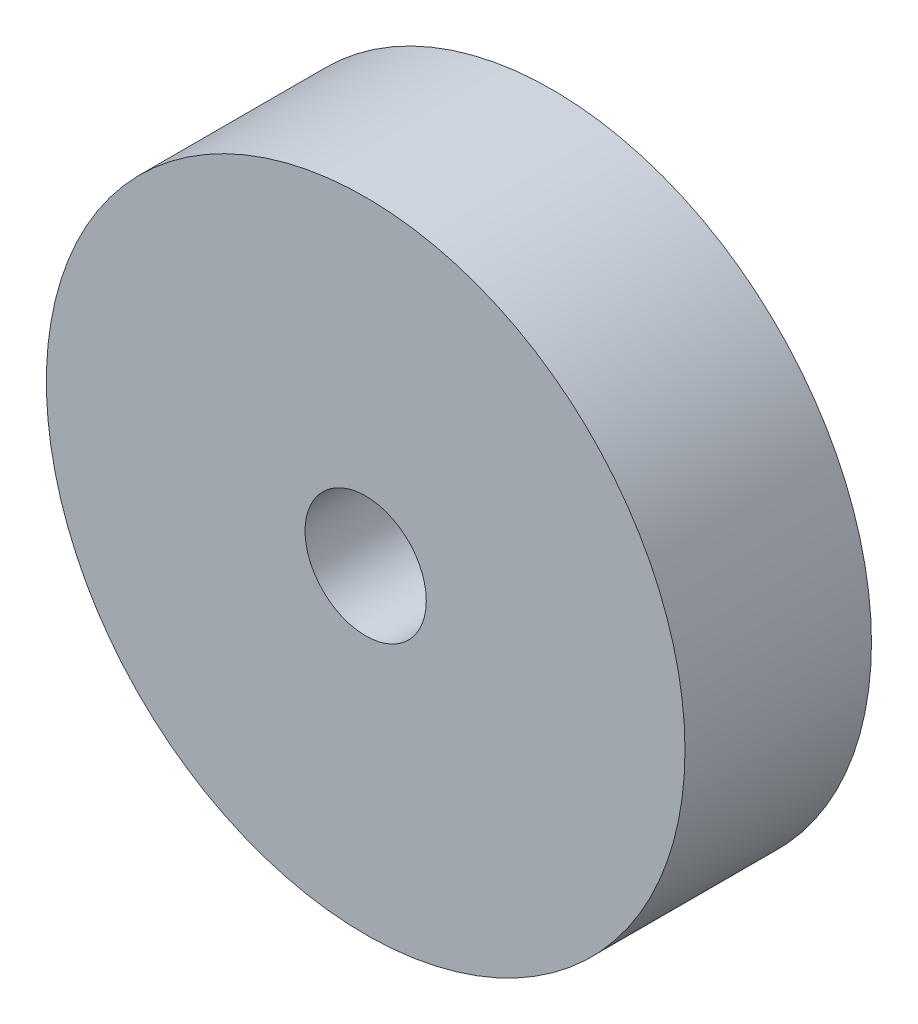
from build123d import *

# Parameters (mm, degrees)
SKETCH1_R           = 68.5
SKETCH1_R_2         = 13
BOSS_EXTRUDE1_DEPTH = 40


with BuildPart() as part:
    # Sketch1 → Boss-Extrude1 (new body)
    with BuildSketch(Plane.XY):
        Circle(SKETCH1_R)
        Circle(SKETCH1_R_2, mode=Mode.SUBTRACT)
    extrude(amount=BOSS_EXTRUDE1_DEPTH)


solid = part.part
